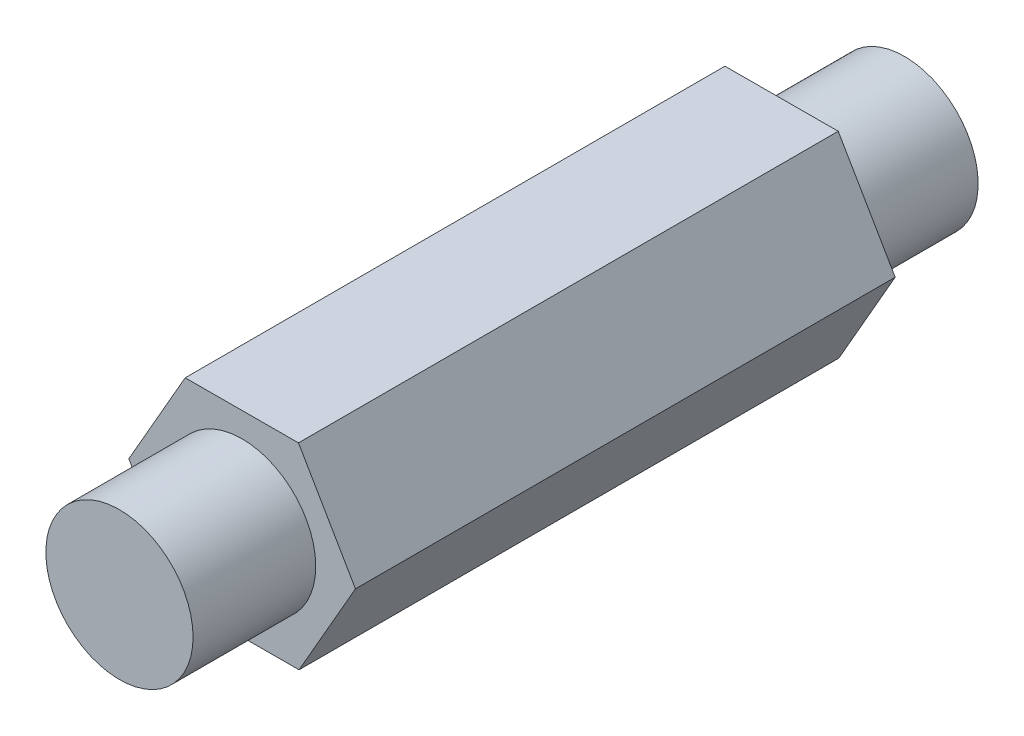
from build123d import *

# Parameters (mm, degrees)
BOSS_EXTRUDE1_DEPTH = 25.4
SKETCH2_R           = 7.332348419
SKETCH2_R_2         = 4.7625
CUT_EXTRUDE1_DEPTH  = 7.9375
CUT_EXTRUDE2_START  = -7.9375
SKETCH3_R           = 7.332348419
SKETCH3_R_2         = 4.7625
CUT_EXTRUDE2_DEPTH  = 7.9375


with BuildPart() as part:
    # Sketch1 → Boss-Extrude1 (new, symmetric)
    with BuildSketch(Plane.XY):
        Polygon((3.684589596, -6.339332208), (7.332317533, 0.021282089), (3.647727937, 6.360614297), (-3.684589596, 6.339332208), (-7.332317533, -0.021282089), (-3.647727937, -6.360614297), align=None)
    extrude(amount=BOSS_EXTRUDE1_DEPTH, both=True)

    # Sketch2 → Cut-Extrude1 (cut)
    with BuildSketch(Plane.XY.offset(25.4)):
        Circle(SKETCH2_R)
        Circle(SKETCH2_R_2, mode=Mode.SUBTRACT)
    extrude(amount=-CUT_EXTRUDE1_DEPTH, mode=Mode.SUBTRACT)

    # Sketch3 → Cut-Extrude2 (cut)
    with BuildSketch(Plane(origin=(0, 0, -25.4), x_dir=(-1, 0, 0), z_dir=(0, 0, -1)).offset(CUT_EXTRUDE2_START)):
        Circle(SKETCH3_R)
        with Locations(Location((0, 0, 0), (0, 0, 180))):
            Circle(SKETCH3_R_2, mode=Mode.SUBTRACT)
    extrude(amount=CUT_EXTRUDE2_DEPTH, mode=Mode.SUBTRACT)


solid = part.part
